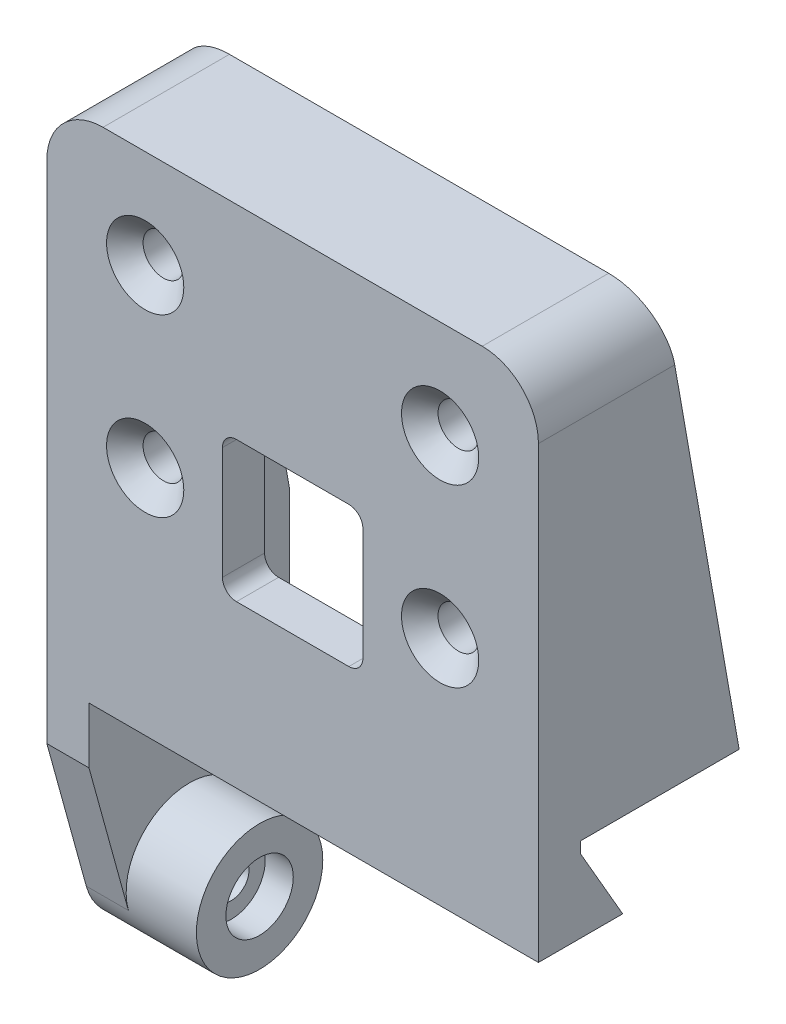
from build123d import *

# Parameters (mm, degrees)
SKETCH1_W                                         = 35
SKETCH1_H                                         = 30
BOSS_EXTRUDE1_DEPTH                               = 3
SKETCH2_W                                         = 35
SKETCH2_H                                         = 30
SKETCH2_W_2                                       = 29
SKETCH2_H_2                                       = 24
BOSS_EXTRUDE2_DEPTH                               = 3
SKETCH3_W                                         = 10
SKETCH3_H                                         = 10
CUT_EXTRUDE1_DEPTH                                = 3
CSK_FOR_M2_5_FLAT_HEAD_MACHINE_SCREW1_D           = 2.9
CSK_FOR_M2_5_FLAT_HEAD_MACHINE_SCREW1_DEPTH       = 5
CSK_FOR_M2_5_FLAT_HEAD_MACHINE_SCREW1_CSINK_D     = 5.5
CSK_FOR_M2_5_FLAT_HEAD_MACHINE_SCREW1_CSINK_ANGLE = 90
CSK_FOR_M2_5_FLAT_HEAD_MACHINE_SCREW1_TIP         = 0.871247898
BOSS_EXTRUDE4_DEPTH                               = 3
FILLET1_R                                         = 1
BOSS_EXTRUDE5_REACH                               = 26.494
SKETCH15_W                                        = 29
SKETCH15_H                                        = 3
SKETCH16_W                                        = 29
SKETCH16_H                                        = 3
CUT_EXTRUDE6_DEPTH                                = 3
FILLET2_R                                         = 4
FILLET3_R                                         = 2
SKETCH21_W                                        = 14.289809421
SKETCH21_H                                        = 25
BOSS_EXTRUDE7_DEPTH                               = 3
SKETCH23_W                                        = 32
SKETCH23_H                                        = 6
BOSS_EXTRUDE8_DEPTH                               = 3
BOSS_EXTRUDE10_DEPTH                              = 32
SKETCH30_R                                        = 1.25
CUT_EXTRUDE13_DEPTH                               = 56.03815634
SKETCH32_R                                        = 4.5
SKETCH32_R_2                                      = 2.4
BOSS_EXTRUDE12_DEPTH                              = 5
SKETCH33_R                                        = 2.75
CUT_EXTRUDE15_DEPTH                               = 4.5
SKETCH32_4_R                                      = 2.4
SKETCH32_4_R_2                                    = 1.25
BOSS_EXTRUDE13_DEPTH                              = 3
SKETCH34_R                                        = 2.75
CUT_EXTRUDE17_DEPTH                               = 4.5
CUT_EXTRUDE18_DEPTH                               = 54.18081095


with BuildPart() as part:
    # Sketch1 → Boss-Extrude1 (new body)
    with BuildSketch(Plane.XY):
        Rectangle(SKETCH1_W, SKETCH1_H)
    extrude(amount=-BOSS_EXTRUDE1_DEPTH)

    # Sketch2 → Boss-Extrude2 (add)
    with BuildSketch(Plane(origin=(0, 0, -3), x_dir=(-1, 0, 0), z_dir=(0, 0, -1))):
        Rectangle(SKETCH2_W, SKETCH2_H)
        Rectangle(SKETCH2_W_2, SKETCH2_H_2, mode=Mode.SUBTRACT)
    extrude(amount=BOSS_EXTRUDE2_DEPTH)

    # Sketch3 → Cut-Extrude1 (cut)
    with BuildSketch(Plane.XY):
        with Locations((0, -4.5)):
            Rectangle(SKETCH3_W, SKETCH3_H)
    extrude(amount=-CUT_EXTRUDE1_DEPTH, mode=Mode.SUBTRACT)

    # CSK for M2.5 Flat Head Machine Screw1
    with Locations(Plane.XY):
        with Locations((10.5, 8), (-10.5, -4.5), (-10.5, 8), (10.5, -4.5)):
            CounterSinkHole(CSK_FOR_M2_5_FLAT_HEAD_MACHINE_SCREW1_D / 2, CSK_FOR_M2_5_FLAT_HEAD_MACHINE_SCREW1_CSINK_D / 2, depth=CSK_FOR_M2_5_FLAT_HEAD_MACHINE_SCREW1_DEPTH, counter_sink_angle=CSK_FOR_M2_5_FLAT_HEAD_MACHINE_SCREW1_CSINK_ANGLE)
            with Locations((0, 0, -(CSK_FOR_M2_5_FLAT_HEAD_MACHINE_SCREW1_DEPTH + CSK_FOR_M2_5_FLAT_HEAD_MACHINE_SCREW1_TIP / 2))):  # 118° drill point
                Cone(0, CSK_FOR_M2_5_FLAT_HEAD_MACHINE_SCREW1_D / 2, CSK_FOR_M2_5_FLAT_HEAD_MACHINE_SCREW1_TIP, mode=Mode.SUBTRACT)

    # Sketch11 → Boss-Extrude4 (add)
    with BuildSketch(Plane.ZY.offset(17.5)):
        Polygon((-6, 15), (-9, 15), (-14.289809421, -15), (-6, -15), align=None)
    boss_extrude4 = extrude(amount=-BOSS_EXTRUDE4_DEPTH)

    # Mirror1: Boss-Extrude4 across plane
    add(boss_extrude4.mirror(Plane(origin=(0, 0, 0), x_dir=(0, 0, 1), z_dir=(1, 0, 0))))

    # Fillet1
    fillet1_edges = [part.edges().sort_by_distance(p)[0] for p in [
        (5, 0.5, -1.5),
        (5, -9.5, -1.5),
        (-5, -9.5, -1.5),
        (-5, 0.5, -1.5),
    ]]
    fillet(fillet1_edges, radius=FILLET1_R)

    # Boss-Extrude5: up to this face of the body (flat: up to its plane)
    boss_extrude5_end = Plane(part.part.faces().sort_by_distance((16, 0, -11.644904711))[0])
    # Sketch15 → Boss-Extrude5 (add, up to the picked face)
    with BuildSketch(Plane(origin=(0, 0, -6), x_dir=(-1, 0, 0), z_dir=(0, 0, -1)), mode=Mode.PRIVATE) as boss_extrude5_sk1:
        with Locations((0, 13.5)):
            Rectangle(SKETCH15_W, SKETCH15_H)
    boss_extrude5_tool1 = split(extrude(boss_extrude5_sk1.sketch, amount=BOSS_EXTRUDE5_REACH, mode=Mode.PRIVATE), bisect_by=boss_extrude5_end, keep=Keep.BOTH, mode=Mode.PRIVATE)
    add(boss_extrude5_tool1.solids().sort_by(Axis((0, 13.5, -6), (0, 0, -1)))[0])

    # Sketch16 → Cut-Extrude6 (cut)
    with BuildSketch(Plane.XZ.offset(15)):
        with Locations((0, -4.5)):
            Rectangle(SKETCH16_W, SKETCH16_H)
    extrude(amount=-CUT_EXTRUDE6_DEPTH, mode=Mode.SUBTRACT)

    # Fillet2
    fillet2_edges = [part.edges().sort_by_distance(p)[0] for p in [
        (-17.5, 15, -4.5),
        (17.5, 15, -4.5),
    ]]
    fillet(fillet2_edges, radius=FILLET2_R)

    # Fillet3
    fillet3_edges = [part.edges().sort_by_distance(p)[0] for p in [
        (-14.5, 12, -6.264490471),
        (14.5, 12, -6.264490471),
    ]]
    fillet(fillet3_edges, radius=FILLET3_R)

    # Sketch21 → Boss-Extrude7 (add)
    with BuildSketch(Plane.ZY.offset(17.5)):
        with Locations((-7.144904711, -27.5)):
            Rectangle(SKETCH21_W, SKETCH21_H)
    extrude(amount=-BOSS_EXTRUDE7_DEPTH)

    # Sketch23 → Boss-Extrude8 (add)
    with BuildSketch(Plane.XY):
        with Locations((1.5, -18)):
            Rectangle(SKETCH23_W, SKETCH23_H)
    extrude(amount=-BOSS_EXTRUDE8_DEPTH)

    # Sketch27 → Boss-Extrude10 (add)
    with BuildSketch(Plane(origin=(17.5, 0, 0), x_dir=(0, 0, -1), z_dir=(1, 0, 0))):
        Polygon((3, -21), (3, -15.803847577), (6, -21), align=None)
    extrude(amount=-BOSS_EXTRUDE10_DEPTH)

    # Sketch30 → Cut-Extrude13 (cut, through all)
    with BuildSketch(Plane.ZY.offset(17.5)):
        with Locations((-7.144904711, -34)):
            Circle(SKETCH30_R)
    extrude(amount=-CUT_EXTRUDE13_DEPTH, mode=Mode.SUBTRACT)

    # Sketch32 → Boss-Extrude12 (add)
    with BuildSketch(Plane(origin=(-14.5, 0, 0), x_dir=(0, 0, -1), z_dir=(1, 0, 0))):
        with Locations((7.144904711, -34)):
            Circle(SKETCH32_R)
        with Locations(Location((7.144904711, -34, 0), (0, 0, 90))):
            Circle(SKETCH32_R_2, mode=Mode.SUBTRACT)
    extrude(amount=BOSS_EXTRUDE12_DEPTH)

    # Sketch33 → Cut-Extrude15 (cut)
    with BuildSketch(Plane.ZY.offset(17.5)):
        with Locations((-7.144904711, -34)):
            Circle(SKETCH33_R)
    extrude(amount=-CUT_EXTRUDE15_DEPTH, mode=Mode.SUBTRACT)

    # Sketch32<4> → Boss-Extrude13 (add)
    with BuildSketch(Plane(origin=(-14.5, 0, 0), x_dir=(0, 0, -1), z_dir=(1, 0, 0))):
        with Locations((7.144904711, -34)):
            Circle(SKETCH32_4_R)
        with Locations((7.144904711, -34)):
            Circle(SKETCH32_4_R_2, mode=Mode.SUBTRACT)
    extrude(amount=BOSS_EXTRUDE13_DEPTH)

    # Sketch34 → Cut-Extrude17 (cut)
    with BuildSketch(Plane.ZY.offset(17.5)):
        with Locations((-7.144904711, -34)):
            Circle(SKETCH34_R)
    extrude(amount=-CUT_EXTRUDE17_DEPTH, mode=Mode.SUBTRACT)

    # Sketch35 → Cut-Extrude18 (cut, through all)
    with BuildSketch(Plane(origin=(-14.5, 0, 0), x_dir=(0, 0, -1), z_dir=(1, 0, 0))):
        with BuildLine():
            Line((2.806290635, -35.194331572), (0, -25))
            Line((0, -25), (0, -40))
            Line((0, -40), (14.289809421, -40))
            Line((14.289809421, -40), (14.289809421, -25))
            Line((14.289809421, -25), (11.483518786, -35.194331572))
            ThreePointArc((11.483518786, -35.194331572), (7.144904711, -38.5), (2.806290635, -35.194331572))
        make_face()
    extrude(amount=-CUT_EXTRUDE18_DEPTH, mode=Mode.SUBTRACT)


solid = part.part
